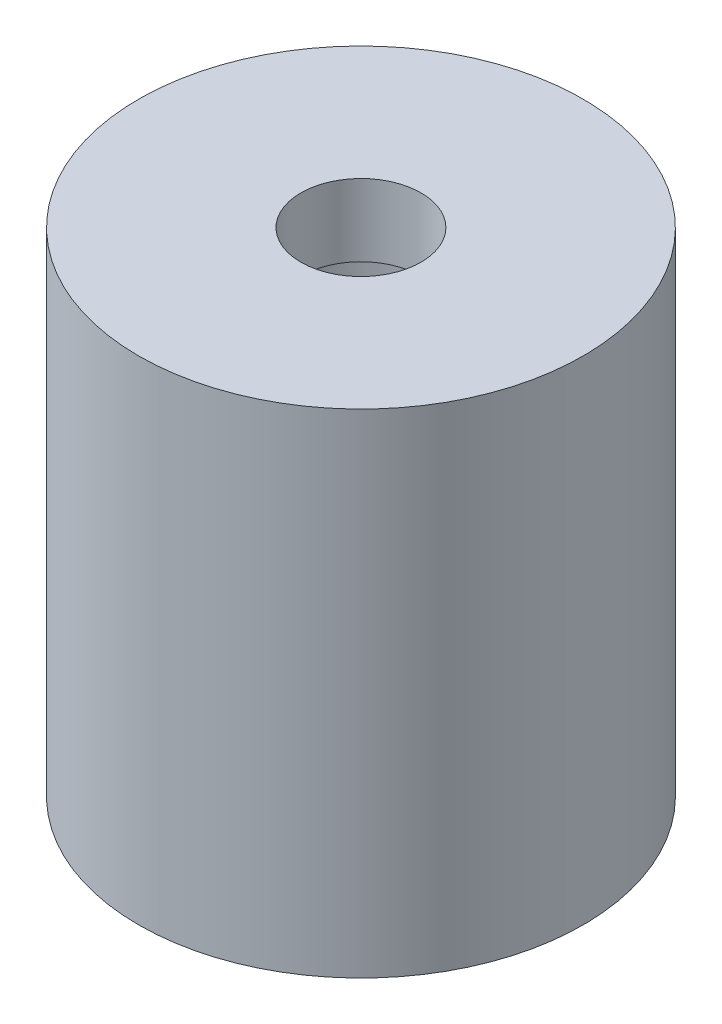
from build123d import *

# Parameters (mm, degrees)
SKETCH_1_R      = 37
SKETCH_1_R_2    = 20
EXTRUDE_1_DEPTH = 70
SKETCH_2_R      = 37
SKETCH_2_R_2    = 10
EXTRUDE_2_DEPTH = 12


with BuildPart() as part:
    # Эскиз1 → Бобышка-Вытянуть1 (new body)
    with BuildSketch(Plane(origin=(0, 0, 0), x_dir=(1, 0, 0), z_dir=(0, 1, 0))):
        with Locations(Location((0, 0, 0), (0, 0, 270))):
            Circle(SKETCH_1_R)
        with Locations(Location((0, 0, 0), (0, 0, 270))):
            Circle(SKETCH_1_R_2, mode=Mode.SUBTRACT)
    extrude(amount=EXTRUDE_1_DEPTH)

    # Эскиз2 → Бобышка-Вытянуть2 (add)
    with BuildSketch(Plane(origin=(0, 70, 0), x_dir=(1, 0, 0), z_dir=(0, 1, 0))):
        with Locations(Location((0, 0, 0), (0, 0, 270))):
            Circle(SKETCH_2_R)
        with Locations(Location((0, 0, 0), (0, 0, 270))):
            Circle(SKETCH_2_R_2, mode=Mode.SUBTRACT)
    extrude(amount=EXTRUDE_2_DEPTH)


solid = part.part
